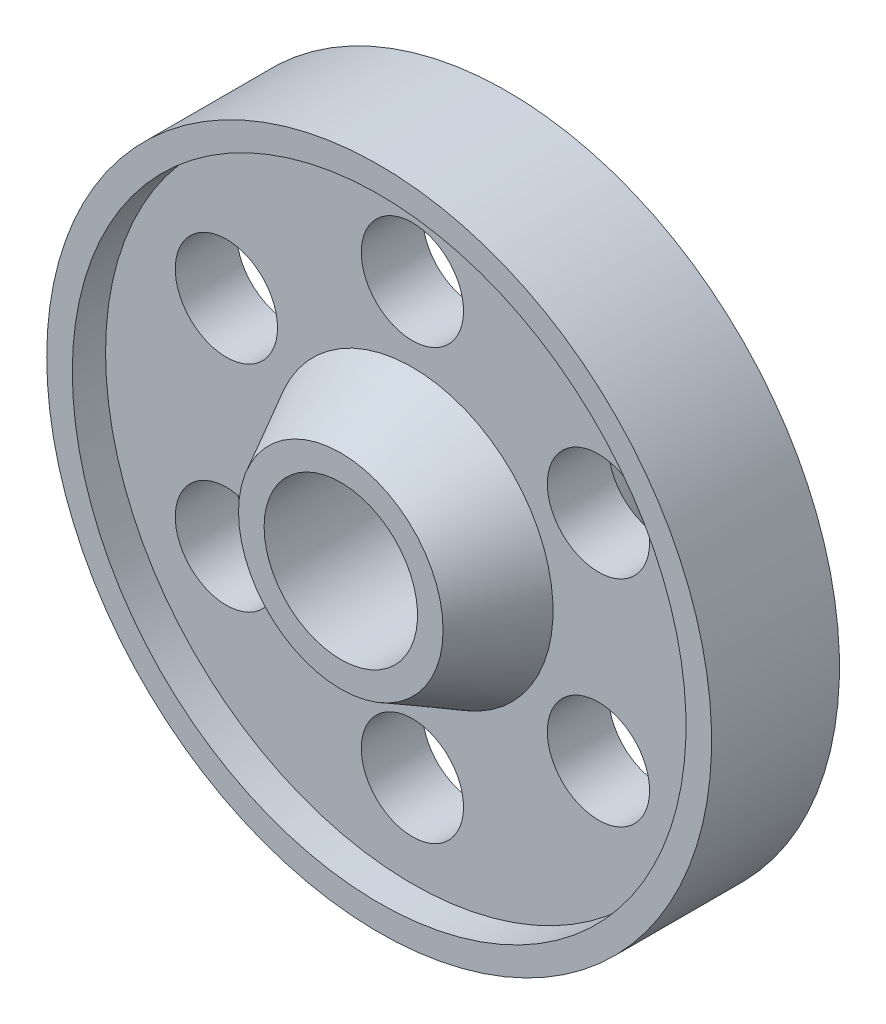
from build123d import *

# Parameters (mm, degrees)
CUT_EXTRUDE1_DEPTH      = 96.530099969
CUT_EXTRUDE1_DEPTH_BACK = 96.530099969
SKETCH2_R               = 10


with BuildPart() as part:
    # Sketch1 → Revolve1 (revolve)
    with BuildSketch(Plane(origin=(0, 0, 0), x_dir=(0, 0, -1), z_dir=(1, 0, 0)), mode=Mode.PRIVATE) as revolve1_sk:
        Polygon((12.5, 65), (-12.5, 65), (-12.5, 60), (-6, 60), (-6, 41.964344451), (-6, 27.5), (-20, 20), (-20, 15), (20, 15), (20, 20), (6, 27.5), (6, 41.964344451), (6, 60), (12.5, 60), align=None)
    revolve(revolve1_sk.sketch.rotate(Axis((0, 0, -27.705838771), (0, 0, 1)), 90), axis=Axis((0, 0, -27.705838771), (0, 0, 1)))

    # Sketch2 → Cut-Extrude1 (cut, two sides: drawn at the far end of the back side and taken through both)
    with BuildSketch(Plane.XY.offset(6).offset(-CUT_EXTRUDE1_DEPTH_BACK)):
        with Locations((0, 42)):
            Circle(SKETCH2_R)
        with Locations((36.373066959, 21)):
            Circle(SKETCH2_R)
        with Locations((36.373066959, -21)):
            Circle(SKETCH2_R)
        with Locations((0, -42)):
            Circle(SKETCH2_R)
        with Locations((-36.373066959, -21)):
            Circle(SKETCH2_R)
        with Locations((-36.373066959, 21)):
            Circle(SKETCH2_R)
    extrude(amount=CUT_EXTRUDE1_DEPTH + CUT_EXTRUDE1_DEPTH_BACK, mode=Mode.SUBTRACT)


solid = part.part
